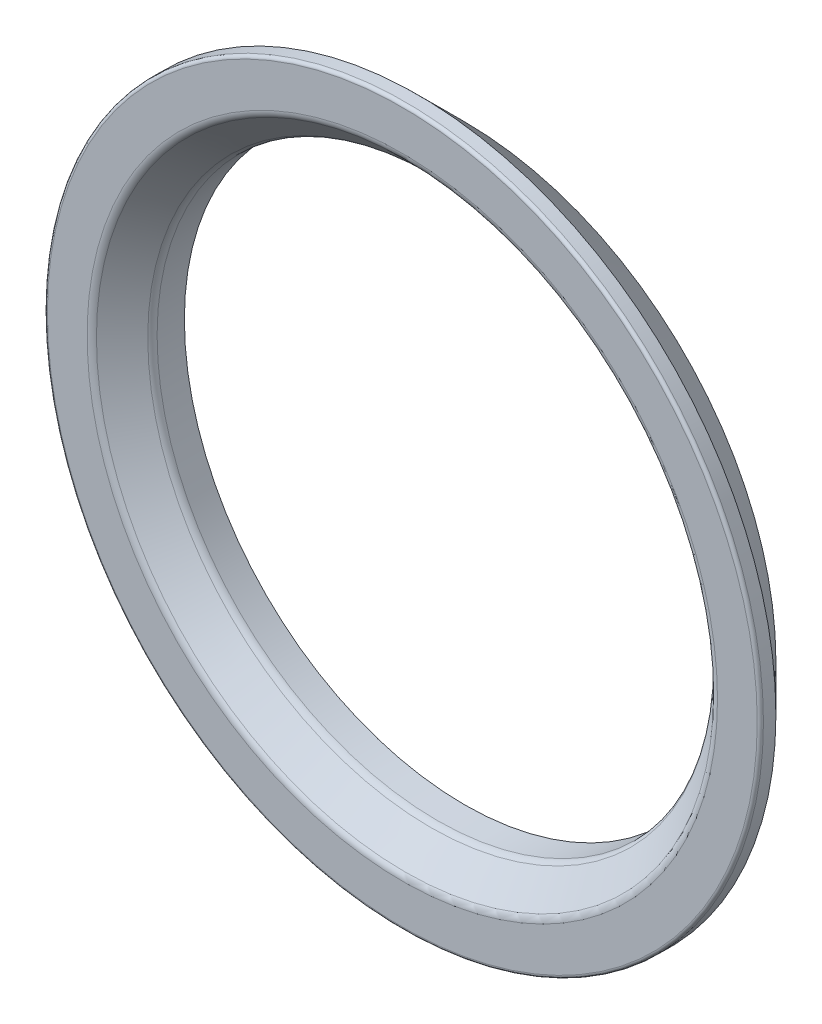
from build123d import *

# Parameters (mm, degrees)
SKETCH1_R           = 11.5
BOSS_EXTRUDE1_DEPTH = 2
CHAMFER1_SIZE       = 1.5
SKETCH3_R           = 9
CUT_EXTRUDE1_DEPTH  = 2
CHAMFER2_SIZE       = 1
FILLET1_R           = 0.3
FILLET2_R           = 0.1


with BuildPart() as part:
    # Sketch1 → Boss-Extrude1 (new body)
    with BuildSketch(Plane.XY):
        Circle(SKETCH1_R)
    extrude(amount=BOSS_EXTRUDE1_DEPTH)

    # Chamfer1
    chamfer1_edges = [part.edges().sort_by_distance(p)[0] for p in [
        (-11.5, 0, 0),
    ]]
    chamfer(chamfer1_edges, length=CHAMFER1_SIZE)

    # Sketch3 → Cut-Extrude1 (cut)
    with BuildSketch(Plane.XY.offset(2)):
        Circle(SKETCH3_R)
    extrude(amount=-CUT_EXTRUDE1_DEPTH, mode=Mode.SUBTRACT)

    # Chamfer2
    chamfer2_edges = [part.edges().sort_by_distance(p)[0] for p in [
        (-9, 0, 2),
    ]]
    chamfer(chamfer2_edges, length=CHAMFER2_SIZE)

    # Fillet1
    fillet1_edges = [part.edges().sort_by_distance(p)[0] for p in [
        (-9, 0, 1),
        (-10, 0, 2),
    ]]
    fillet(fillet1_edges, radius=FILLET1_R)

    # Fillet2
    fillet2_edges = [part.edges().sort_by_distance(p)[0] for p in [
        (-11.5, 0, 2),
    ]]
    fillet(fillet2_edges, radius=FILLET2_R)


solid = part.part
